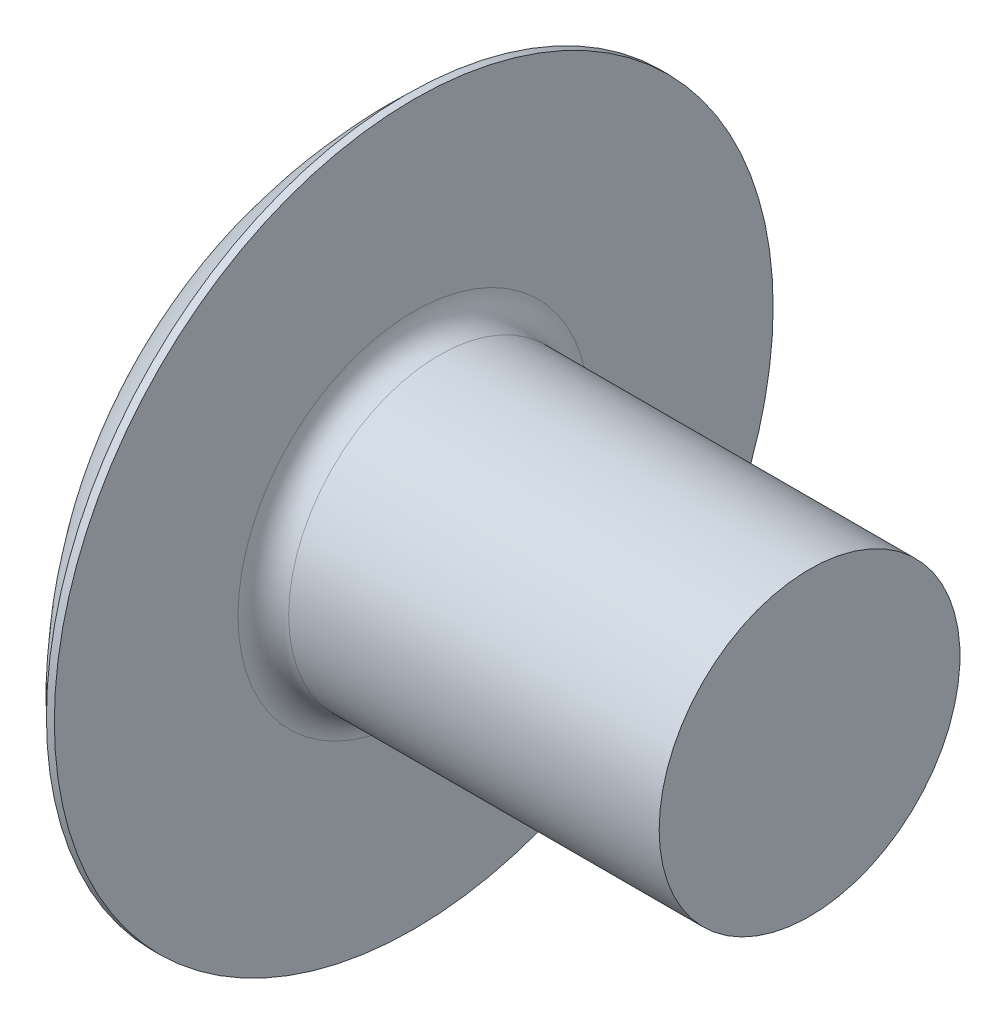
from build123d import *


with BuildPart() as part:
    # BodySke → Base-Revolve (revolve)
    with BuildSketch(Plane.XY, mode=Mode.PRIVATE) as base_revolve_sk:
        with BuildLine():
            Line((0, 0), (8.9916, 0))
            Line((8.9916, 0), (8.9916, 2.413))
            Line((8.9916, 2.413), (3.048, 2.413))
            ThreePointArc((3.048, 2.413), (2.760631804, 2.532031804), (2.6416, 2.8194))
            Line((2.6416, 2.8194), (2.6416, 5.7658))
            Line((2.6416, 5.7658), (2.5146, 5.7658))
            ThreePointArc((2.5146, 5.7658), (0.655998548, 3.145141603), (0, 0))
        make_face()
    revolve(base_revolve_sk.sketch.rotate(Axis((0, 0, 0), (1, 0, 0)), 90), axis=Axis((0, 0, 0), (1, 0, 0)))


solid = part.part
